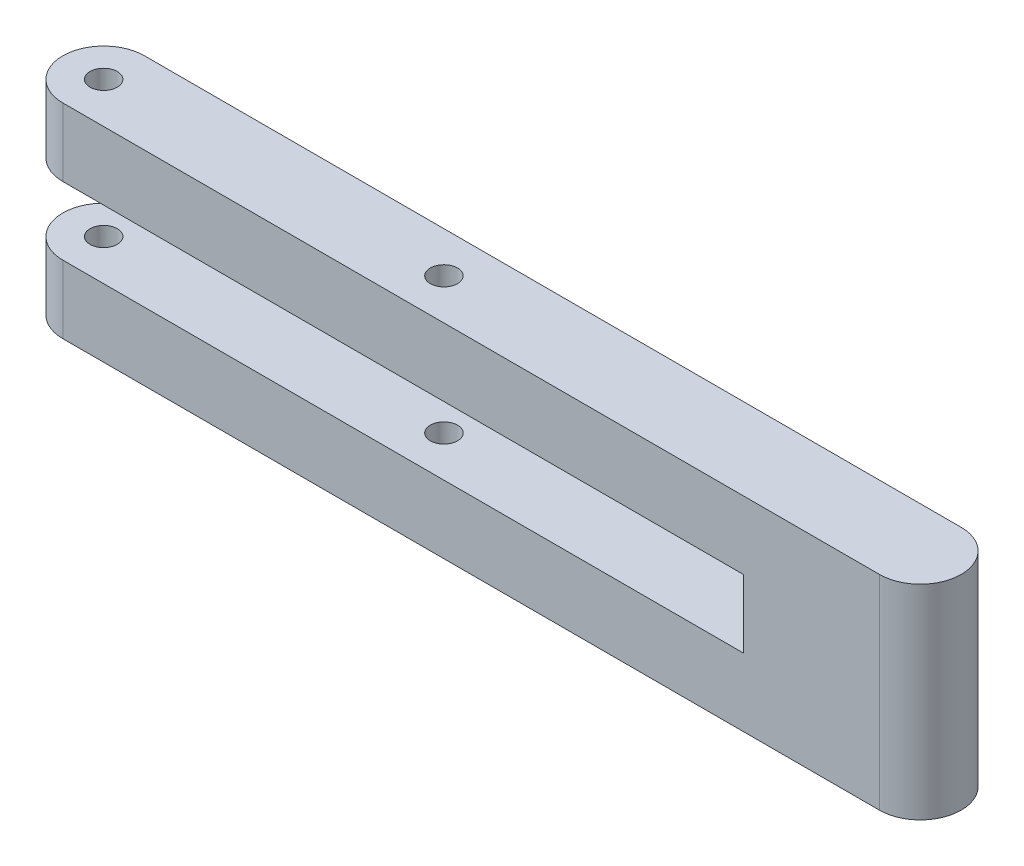
from build123d import *

# Parameters (mm, degrees)
BOSS_EXTRUDE1_DEPTH     = 38.1
SKETCH4_R               = 2.54
CUT_EXTRUDE3_DEPTH      = 105.047031673
CUT_EXTRUDE4_DEPTH      = 6.35
CUT_EXTRUDE4_DEPTH_BACK = 6.35


with BuildPart() as part:
    # Sketch3 → Boss-Extrude1 (new body)
    with BuildSketch(Plane(origin=(0, 0, 0), x_dir=(1, 0, 0), z_dir=(0, 1, 0))):
        with BuildLine():
            Line((-63.5, 7.62), (88.9, 7.62))
            ThreePointArc((88.9, 7.62), (96.52, 0), (88.9, -7.62))
            Line((88.9, -7.62), (-63.5, -7.62))
            ThreePointArc((-63.5, -7.62), (-71.12, 0), (-63.5, 7.62))
        make_face()
    extrude(amount=BOSS_EXTRUDE1_DEPTH)

    # Sketch4 → Cut-Extrude3 (cut, through all)
    with BuildSketch(Plane(origin=(0, 38.1, 0), x_dir=(1, 0, 0), z_dir=(0, 1, 0))):
        with Locations(Location((-63.5, 0, 0), (0, 0, 270))):
            Circle(SKETCH4_R)
        with Locations(Location((0, 0, 0), (0, 0, 270))):
            Circle(SKETCH4_R)
    extrude(amount=-CUT_EXTRUDE3_DEPTH, mode=Mode.SUBTRACT)

    # Sketch5 → Cut-Extrude4 (cut, two sides: drawn at the far end of the back side and taken through both)
    with BuildSketch(Plane(origin=(0, 19.05, 0), x_dir=(1, 0, 0), z_dir=(0, 1, 0)).offset(-CUT_EXTRUDE4_DEPTH_BACK)):
        with BuildLine():
            Line((31.75, 7.62), (-63.5, 7.62))
            ThreePointArc((-63.5, 7.62), (-71.12, 0), (-63.5, -7.62))
            Line((-63.5, -7.62), (0, -7.62))
            Line((0, -7.62), (63.5, -7.62))
            Line((63.5, -7.62), (63.5, 7.62))
            Line((63.5, 7.62), (31.75, 7.62))
        make_face()
    extrude(amount=CUT_EXTRUDE4_DEPTH + CUT_EXTRUDE4_DEPTH_BACK, mode=Mode.SUBTRACT)


solid = part.part
